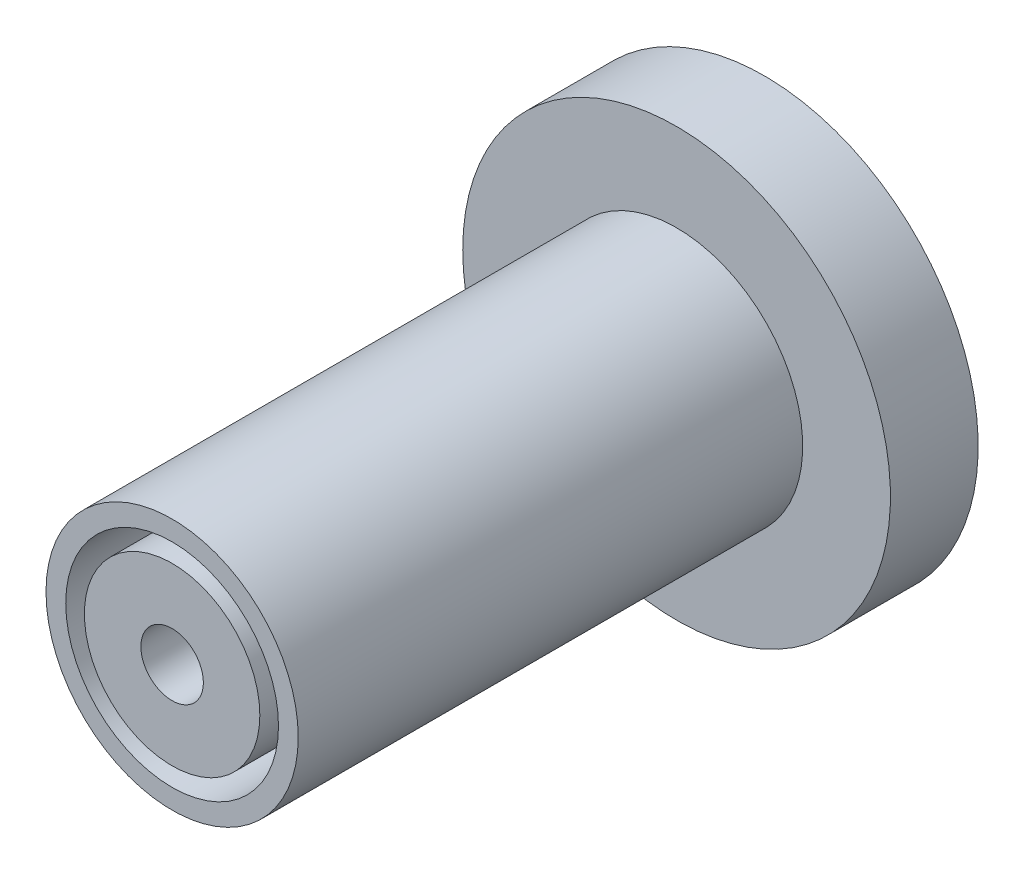
from build123d import *

# Parameters (mm, degrees)
SKETCH2_R           = 5.75
BOSS_EXTRUDE1_DEPTH = 6
SKETCH3_R           = 4.85
CUT_EXTRUDE1_DEPTH  = 4
SKETCH4_R           = 4.75
BOSS_EXTRUDE2_DEPTH = 21
CUT_EXTRUDE2_DEPTH  = 21
SKETCH7_R           = 4
BOSS_EXTRUDE3_DEPTH = 3.2
SKETCH8_R           = 1.425
CUT_EXTRUDE3_DEPTH  = 2.8
SKETCH11_R          = 5.75
SKETCH11_R_2        = 4.75
BOSS_EXTRUDE5_DEPTH = 21
SKETCH12_R          = 9.75
SKETCH12_R_2        = 5.75
BOSS_EXTRUDE6_DEPTH = 4


with BuildPart() as part:
    # Sketch2 → Boss-Extrude1 (new body)
    with BuildSketch(Plane.XY):
        Circle(SKETCH2_R)
    extrude(amount=BOSS_EXTRUDE1_DEPTH)

    # Sketch3 → Cut-Extrude1 (cut)
    with BuildSketch(Plane.XY.offset(6)):
        Circle(SKETCH3_R)
    extrude(amount=-CUT_EXTRUDE1_DEPTH, mode=Mode.SUBTRACT)

    # Sketch4 → Boss-Extrude2 (add)
    with BuildSketch(Plane(origin=(0, 0, 0), x_dir=(-1, 0, 0), z_dir=(0, 0, -1))):
        with Locations(Location((0, 0, 0), (0, 0, 180))):
            Circle(SKETCH4_R)
    extrude(amount=BOSS_EXTRUDE2_DEPTH)

    # Sketch5 → Cut-Extrude2 (cut)
    with BuildSketch(Plane(origin=(0, 0, -21), x_dir=(-1, 0, 0), z_dir=(0, 0, -1))):
        with BuildLine():
            Line((-3, 1.880175896), (-3, -1.919824104))
            ThreePointArc((-3, -1.919824104), (0, -3.561702485), (3, -1.919824104))
            Line((3, -1.919824104), (3, 1.880175896))
            ThreePointArc((3, 1.880175896), (0, 3.540488865), (-3, 1.880175896))
        make_face()
    extrude(amount=-CUT_EXTRUDE2_DEPTH, mode=Mode.SUBTRACT)

    # Sketch11 → Boss-Extrude5 (add)
    with BuildSketch(Plane(origin=(0, 0, -21), x_dir=(-1, 0, 0), z_dir=(0, 0, -1))):
        Circle(SKETCH11_R)
        Circle(SKETCH11_R_2, mode=Mode.SUBTRACT)
    extrude(amount=-BOSS_EXTRUDE5_DEPTH)

    # Sketch12 → Boss-Extrude6 (add)
    with BuildSketch(Plane(origin=(0, 0, -21), x_dir=(-1, 0, 0), z_dir=(0, 0, -1))):
        Circle(SKETCH12_R)
        Circle(SKETCH12_R_2, mode=Mode.SUBTRACT)
    extrude(amount=-BOSS_EXTRUDE6_DEPTH)


with BuildPart() as body_2:
    # Sketch7 → Boss-Extrude3 (new body)
    with BuildSketch(Plane.XY.offset(2.8)):
        Circle(SKETCH7_R)
    extrude(amount=BOSS_EXTRUDE3_DEPTH)

    # Sketch8 → Cut-Extrude3 (cut)
    with BuildSketch(Plane.XY.offset(6)):
        Circle(SKETCH8_R)
    extrude(amount=-CUT_EXTRUDE3_DEPTH, mode=Mode.SUBTRACT)


solid = Compound([part.part, body_2.part])
